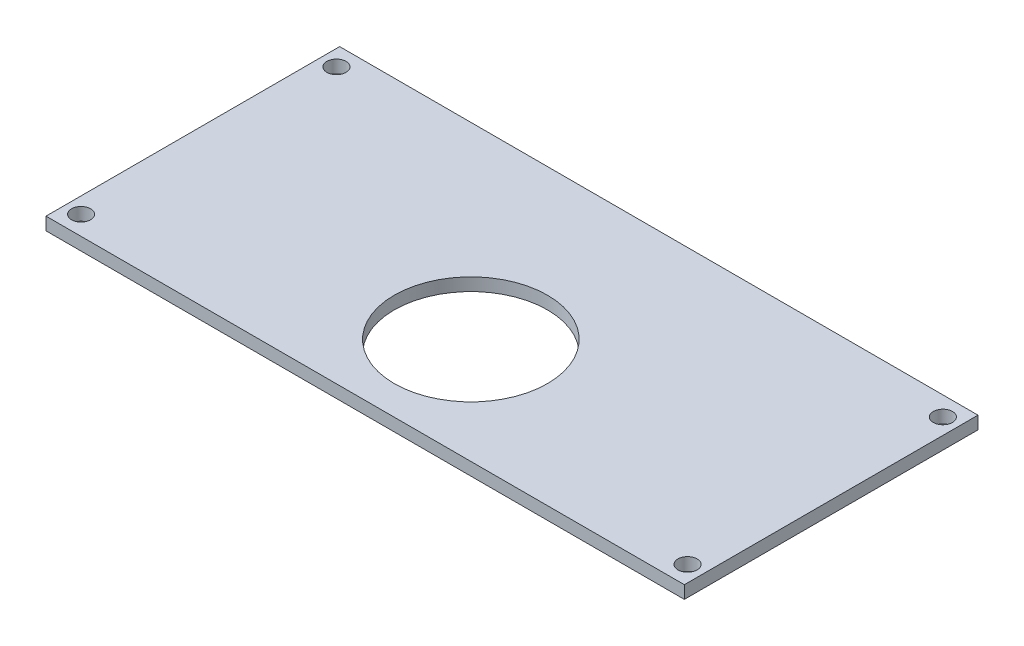
from build123d import *

# Parameters (mm, degrees)
SKETCH_1_W      = 100
SKETCH_1_H      = 46
SKETCH_1_R      = 1.5
SKETCH_1_R_2    = 12
EXTRUDE_1_DEPTH = 2


with BuildPart() as part:
    # 草图1 → 凸台-拉伸1 (new body)
    with BuildSketch(Plane(origin=(0, 0, 0), x_dir=(1, 0, 0), z_dir=(0, 1, 0))):
        with Locations((50, 23)):
            Rectangle(SKETCH_1_W, SKETCH_1_H)
        with Locations(Location((2.5, 43, 0), (0, 0, 270))):
            Circle(SKETCH_1_R, mode=Mode.SUBTRACT)
        with Locations(Location((2.5, 3, 0), (0, 0, 90))):
            Circle(SKETCH_1_R, mode=Mode.SUBTRACT)
        with Locations(Location((97.5, 3, 0), (0, 0, 270))):
            Circle(SKETCH_1_R, mode=Mode.SUBTRACT)
        with Locations(Location((97.5, 43, 0), (0, 0, 90))):
            Circle(SKETCH_1_R, mode=Mode.SUBTRACT)
        with Locations(Location((50, 16.556349186, 0), (0, 0, 270))):
            Circle(SKETCH_1_R_2, mode=Mode.SUBTRACT)
    extrude(amount=EXTRUDE_1_DEPTH)


solid = part.part
